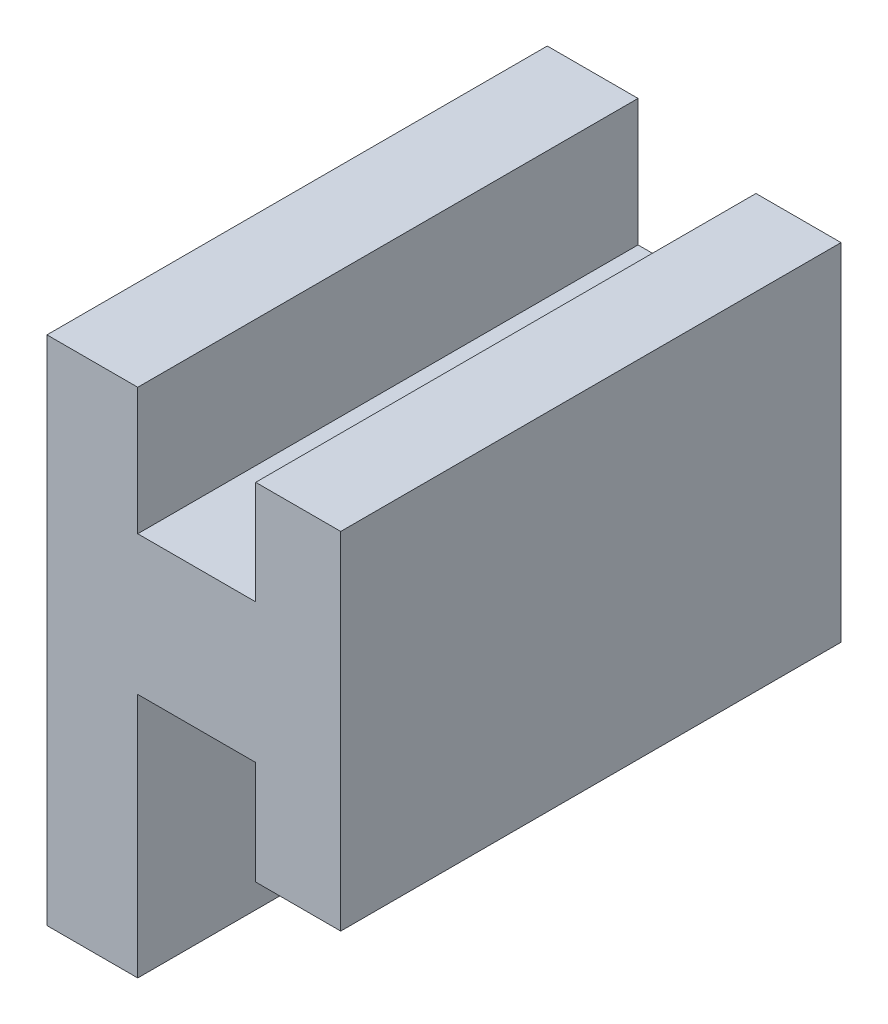
from build123d import *

# Parameters (mm, degrees)
BOSS_EXTRUDE1_DEPTH = 10


with BuildPart() as part:
    # Sketch2 → Boss-Extrude1 (new body)
    with BuildSketch(Plane.XY):
        Polygon((-32.15, -9.683023841), (-32.15, -12.219217722), (-29.792797906, -12.219217722), (-29.792797906, -10.15), (-28.092797906, -10.15), (-28.092797906, -17.068869174), (-29.792797906, -17.068869174), (-29.792797906, -14.999651452), (-32.15, -14.999651452), (-32.15, -19.908982177), (-33.964430759, -19.908982177), (-33.964430759, -9.683023841), align=None)
    extrude(amount=-BOSS_EXTRUDE1_DEPTH)


solid = part.part
